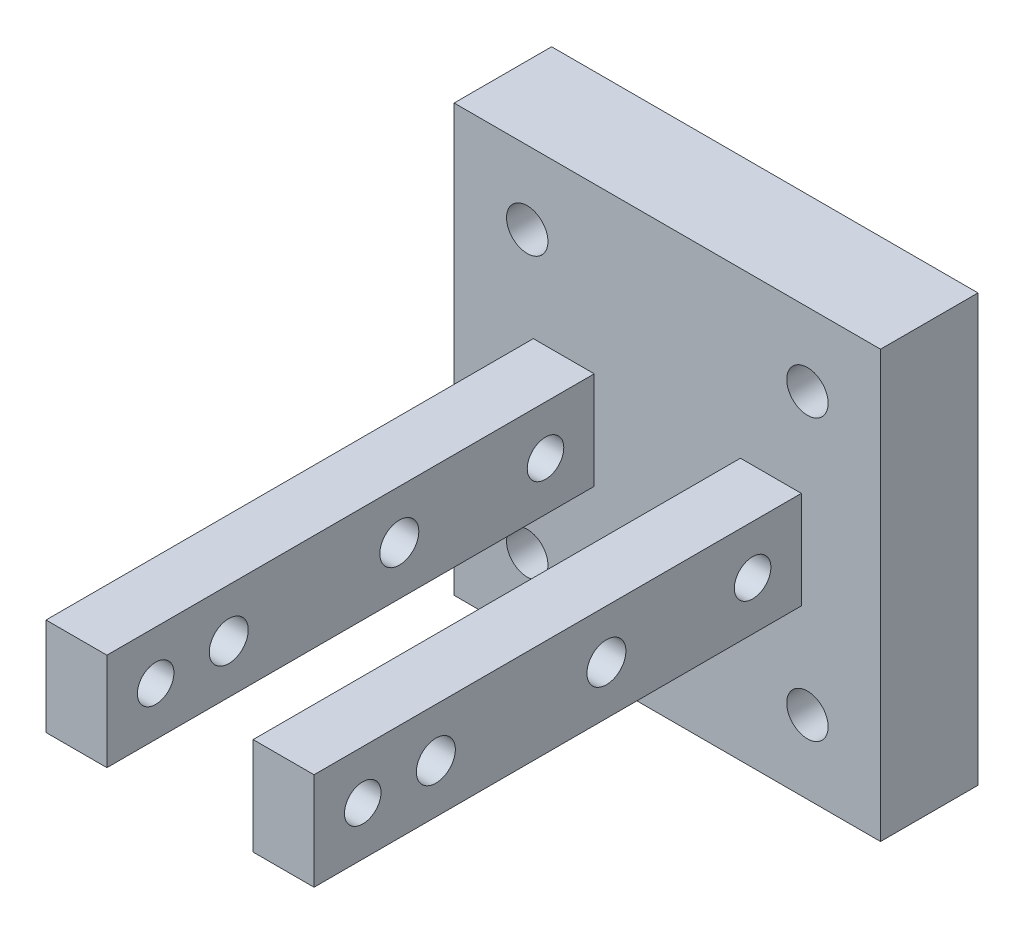
from build123d import *

# Parameters (mm, degrees)
SKETCH_1_W          = 35
SKETCH_1_H          = 35
SKETCH_1_R          = 1.7
EXTRUDE_1_DEPTH     = 8
SKETCH_2_W          = 5
SKETCH_2_H          = 8
EXTRUDE_2_DEPTH     = 40
SKETCH_3_R          = 1.6
CUT_EXTRUDE_1_DEPTH = 40
CUT_EXTRUDE_2_DEPTH = 24


with BuildPart() as part:
    # 草图1 → 凸台-拉伸1 (new body)
    with BuildSketch(Plane.XY):
        with Locations((6.7, -6.931428571)):
            Rectangle(SKETCH_1_W, SKETCH_1_H)
        with Locations((-4.8, 4.568571429)):
            Circle(SKETCH_1_R, mode=Mode.SUBTRACT)
        with Locations((18.2, 4.568571429)):
            Circle(SKETCH_1_R, mode=Mode.SUBTRACT)
        with Locations((-4.8, -18.431428571)):
            Circle(SKETCH_1_R, mode=Mode.SUBTRACT)
        with Locations((18.2, -18.431428571)):
            Circle(SKETCH_1_R, mode=Mode.SUBTRACT)
    extrude(amount=EXTRUDE_1_DEPTH)

    # 草图2 → 凸台-拉伸2 (add)
    with BuildSketch(Plane.XY.offset(8)):
        with Locations((-1.8, -6.931428571)):
            Rectangle(SKETCH_2_W, SKETCH_2_H)
        with Locations((15.2, -6.931428571)):
            Rectangle(SKETCH_2_W, SKETCH_2_H)
    extrude(amount=EXTRUDE_2_DEPTH)

    # 草图3 → 切除-拉伸1 (cut)
    with BuildSketch(Plane(origin=(17.7, 0, 0), x_dir=(0, 0, -1), z_dir=(1, 0, 0))):
        with Locations(Location((-38, -6.931428571, 0), (0, 0, 90))):
            Circle(SKETCH_3_R)
        with Locations(Location((-24, -6.931428571, 0), (0, 0, 90))):
            Circle(SKETCH_3_R)
    extrude(amount=-CUT_EXTRUDE_1_DEPTH, mode=Mode.SUBTRACT)

    # 草图5 → 切除-拉伸2 (cut)
    with BuildSketch(Plane.ZY.offset(4.3)):
        with BuildLine():
            Line((10.5, -6.931428571), (12, -6.931428571))
            Line((12, -6.931428571), (13.5, -6.931428571))
            ThreePointArc((13.5, -6.931428571), (12, -5.431428571), (10.5, -6.931428571))
        make_face()
        with BuildLine():
            Line((13.5, -6.931428571), (12, -6.931428571))
            Line((12, -6.931428571), (10.5, -6.931428571))
            ThreePointArc((10.5, -6.931428571), (12, -8.431428571), (13.5, -6.931428571))
        make_face()
        with BuildLine():
            ThreePointArc((45.5, -6.931428571), (44, -5.431428571), (42.5, -6.931428571))
            Line((42.5, -6.931428571), (44, -6.931428571))
            Line((44, -6.931428571), (45.5, -6.931428571))
        make_face()
        with BuildLine():
            Line((44, -6.931428571), (42.5, -6.931428571))
            ThreePointArc((42.5, -6.931428571), (44, -8.431428571), (45.5, -6.931428571))
            Line((45.5, -6.931428571), (44, -6.931428571))
        make_face()
    extrude(amount=-CUT_EXTRUDE_2_DEPTH, mode=Mode.SUBTRACT)


solid = part.part
